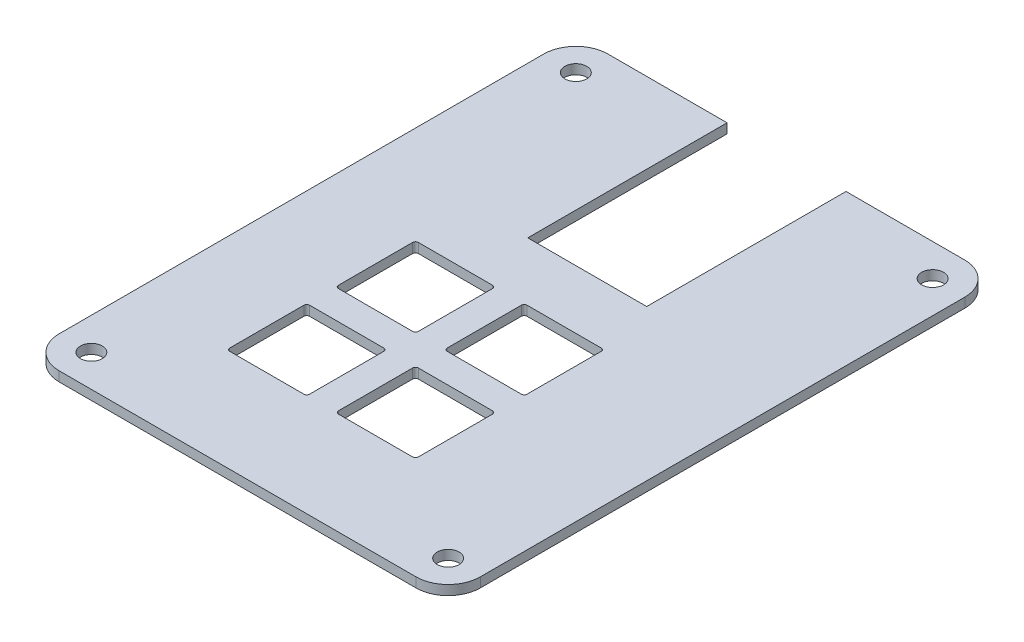
from build123d import *

# Parameters (mm, degrees)
SKETCH1_R           = 1.7
BOSS_EXTRUDE1_DEPTH = 1.5
FILLET1_R           = 5


with BuildPart() as part:
    # Sketch1 → Boss-Extrude1 (new body)
    with BuildSketch(Plane(origin=(0, 0, 0), x_dir=(1, 0, 0), z_dir=(0, 1, 0))):
        Polygon((-12.939466701, 37.882793222), (-12.939466701, -47.467206778), (52.550533299, -47.467206778), (52.550533299, 37.882793222), (29.080533299, 37.882793222), (29.080533299, 6.882793222), (10.580533299, 6.882793222), (10.580533299, 37.882793222), align=None)
        with Locations(Location((-7.939466701, -42.467206778, 0), (0, 0, 270))):
            Circle(SKETCH1_R, mode=Mode.SUBTRACT)
        with BuildLine():
            ThreePointArc((2.241533299, -19.596771318), (2.37153922, -19.282909259), (2.685401279, -19.152903338))
            Line((2.685401279, -19.152903338), (14.22596876, -19.152903338))
            ThreePointArc((14.22596876, -19.152903338), (14.539830818, -19.282909259), (14.66983674, -19.596771318))
            Line((14.66983674, -19.596771318), (14.66983674, -31.137338798))
            ThreePointArc((14.66983674, -31.137338798), (14.539830818, -31.451200857), (14.22596876, -31.581206778))
            Line((14.22596876, -31.581206778), (2.685401279, -31.581206778))
            ThreePointArc((2.685401279, -31.581206778), (2.37153922, -31.451200857), (2.241533299, -31.137338798))
            Line((2.241533299, -31.137338798), (2.241533299, -19.596771318))
        make_face(mode=Mode.SUBTRACT)
        with BuildLine():
            ThreePointArc((2.241533299, -2.685401279), (2.37153922, -2.37153922), (2.685401279, -2.241533299))
            Line((2.685401279, -2.241533299), (14.22596876, -2.241533299))
            ThreePointArc((14.22596876, -2.241533299), (14.539830818, -2.37153922), (14.66983674, -2.685401279))
            Line((14.66983674, -2.685401279), (14.66983674, -14.22596876))
            ThreePointArc((14.66983674, -14.22596876), (14.539830818, -14.539830818), (14.22596876, -14.66983674))
            Line((14.22596876, -14.66983674), (2.685401279, -14.66983674))
            ThreePointArc((2.685401279, -14.66983674), (2.37153922, -14.539830818), (2.241533299, -14.22596876))
            Line((2.241533299, -14.22596876), (2.241533299, -2.685401279))
        make_face(mode=Mode.SUBTRACT)
        with Locations(Location((47.550533299, -42.467206778, 0), (0, 0, 270))):
            Circle(SKETCH1_R, mode=Mode.SUBTRACT)
        with BuildLine():
            ThreePointArc((19.152903338, -19.596771318), (19.282909259, -19.282909259), (19.596771318, -19.152903338))
            Line((19.596771318, -19.152903338), (31.137338798, -19.152903338))
            ThreePointArc((31.137338798, -19.152903338), (31.451200857, -19.282909259), (31.581206778, -19.596771318))
            Line((31.581206778, -19.596771318), (31.581206778, -31.137338798))
            ThreePointArc((31.581206778, -31.137338798), (31.451200857, -31.451200857), (31.137338798, -31.581206778))
            Line((31.137338798, -31.581206778), (19.596771318, -31.581206778))
            ThreePointArc((19.596771318, -31.581206778), (19.282909259, -31.451200857), (19.152903338, -31.137338798))
            Line((19.152903338, -31.137338798), (19.152903338, -19.596771318))
        make_face(mode=Mode.SUBTRACT)
        with BuildLine():
            ThreePointArc((19.152903338, -2.685401279), (19.282909259, -2.37153922), (19.596771318, -2.241533299))
            Line((19.596771318, -2.241533299), (31.137338798, -2.241533299))
            ThreePointArc((31.137338798, -2.241533299), (31.451200857, -2.37153922), (31.581206778, -2.685401279))
            Line((31.581206778, -2.685401279), (31.581206778, -14.22596876))
            ThreePointArc((31.581206778, -14.22596876), (31.451200857, -14.539830818), (31.137338798, -14.66983674))
            Line((31.137338798, -14.66983674), (19.596771318, -14.66983674))
            ThreePointArc((19.596771318, -14.66983674), (19.282909259, -14.539830818), (19.152903338, -14.22596876))
            Line((19.152903338, -14.22596876), (19.152903338, -2.685401279))
        make_face(mode=Mode.SUBTRACT)
        with Locations(Location((-7.939466701, 32.882793222, 0), (0, 0, 270))):
            Circle(SKETCH1_R, mode=Mode.SUBTRACT)
        with Locations(Location((47.550533299, 32.882793222, 0), (0, 0, 270))):
            Circle(SKETCH1_R, mode=Mode.SUBTRACT)
    extrude(amount=BOSS_EXTRUDE1_DEPTH)

    # Fillet1
    fillet1_edges = [part.edges().sort_by_distance(p)[0] for p in [
        (52.550533299, 0.75, -37.882793222),
        (52.550533299, 0.75, 47.467206778),
        (-12.939466701, 0.75, 47.467206778),
        (-12.939466701, 0.75, -37.882793222),
    ]]
    fillet(fillet1_edges, radius=FILLET1_R)


solid = part.part
